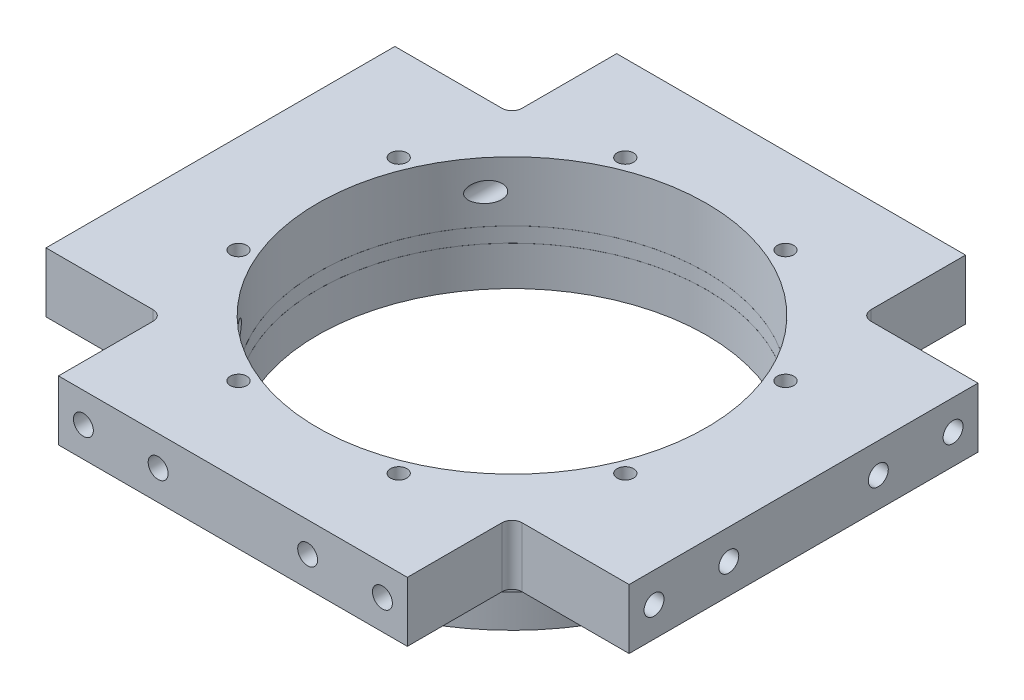
from build123d import *

# Parameters (mm, degrees)
SKETCH_2_OUTSIDE_W          = 233.118
SKETCH_2_OUTSIDE_H          = 233.118
SKETCH_2_OUTSIDE_W_2        = 117
SKETCH_2_OUTSIDE_H_2        = 112
CUT_EXTRUDE_1_DEPTH         = 12
SKETCH_4_R                  = 2
CUT_EXTRUDE_3_DEPTH         = 129.41596474
SKETCH_5_R                  = 2
CUT_EXTRUDE_4_DEPTH         = 12
CUT_EXTRUDE_START           = -105
SKETCH_5_2_R                = 2
CUT_EXTRUDE_5_DEPTH         = 12
SKETCH_6_R                  = 1.65
CUT_EXTRUDE_6_DEPTH         = 100
SKETCH_10_R                 = 2.1
CUT_EXTRUDE_8_DEPTH         = 10.9
PATTERN_CIRCULAR_1_COUNT    = 8
CUT_EXTRUDE_7_DEPTH         = 20
CUT_EXTRUDE_3395_DEPTH      = 85.158540956
CUT_EXTRUDE_3395_DEPTH_BACK = 85.158540956
SKETCH_11_W                 = 136.197392648
SKETCH_11_H                 = 0.01
SKETCH_12_W                 = 23.5
SKETCH_12_H                 = 18
CUT_EXTRUDE_9_DEPTH         = 50
SKETCH_13_W                 = 20.5
SKETCH_13_H                 = 3
CUT_EXTRUDE_10_DEPTH        = 40
F_4_0MM_1_AT_2_COUNT        = 2
F_4_0MM_1_AT_2_PITCH        = 30
F_4_0MM_2_AT_2_COUNT        = 2
F_4_0MM_2_AT_2_PITCH        = 30


with BuildPart() as part:
    # 草图1 → 旋转1 (revolve)
    with BuildSketch(Plane.XY, mode=Mode.PRIVATE) as revolve_1_sk:
        Polygon((-39, 0), (-45, 0), (-45, 7.9), (-46.8, 7.9), (-46.8, 10.9), (-90, 10.9), (-90, 22.9), (-39, 22.9), align=None)
    revolve(revolve_1_sk.sketch.rotate(Axis((0, 0, 0), (0, 1, 0)), 270), axis=Axis((0, 0, 0), (0, 1, 0)))

    # 草图2 outside → 切除-拉伸1 (cut)
    with BuildSketch(Plane(origin=(0, 22.9, 0), x_dir=(1, 0, 0), z_dir=(0, 1, 0))):
        Rectangle(SKETCH_2_OUTSIDE_W, SKETCH_2_OUTSIDE_H)
        Rectangle(SKETCH_2_OUTSIDE_W_2, SKETCH_2_OUTSIDE_H_2, mode=Mode.SUBTRACT)
    extrude(amount=-CUT_EXTRUDE_1_DEPTH, mode=Mode.SUBTRACT)

    # 草图4 → 切除-拉伸3 (cut, through all)
    with BuildSketch(Plane.XY.offset(56)):
        with Locations((-30, 16.9)):
            Circle(SKETCH_4_R)
        with Locations((30, 16.9)):
            Circle(SKETCH_4_R)
    extrude(amount=-CUT_EXTRUDE_3_DEPTH, mode=Mode.SUBTRACT)

    # 草图5 → 切除-拉伸4 (cut)
    with BuildSketch(Plane.ZY.offset(58.5)):
        with Locations((-30, 16.9)):
            Circle(SKETCH_5_R)
        with Locations((30, 16.9)):
            Circle(SKETCH_5_R)
    extrude(amount=-CUT_EXTRUDE_4_DEPTH, mode=Mode.SUBTRACT)

    # 草图5<2> → 切除-拉伸5 (cut)
    with BuildSketch(Plane.ZY.offset(58.5).offset(CUT_EXTRUDE_START)):
        with Locations((-30, 16.9)):
            Circle(SKETCH_5_2_R)
        with Locations((30, 16.9)):
            Circle(SKETCH_5_2_R)
    extrude(amount=-CUT_EXTRUDE_5_DEPTH, mode=Mode.SUBTRACT)

    # 草图6 → 切除-拉伸6 (cut)
    with BuildSketch(Plane.XZ):
        with Locations(Location((-16.072704159, -38.802940365, 0), (0, 0, 270))):
            Circle(SKETCH_6_R)
    cut_extrude_6 = extrude(amount=-CUT_EXTRUDE_6_DEPTH, mode=Mode.SUBTRACT)

    # 草图10 → 切除-拉伸8 (cut)
    with BuildSketch(Plane.XZ):
        with Locations(Location((-16.072704159, -38.802940365, 0), (0, 0, 270))):
            Circle(SKETCH_10_R)
    cut_extrude_8 = extrude(amount=-CUT_EXTRUDE_8_DEPTH, mode=Mode.SUBTRACT)

    # 阵列(圆周)1: 切除-拉伸6, 切除-拉伸8 ×8 about axis
    pattern_circular_1_axis = Axis((0, 0, 0), (0, 1, 0))
    add([cut_extrude_6.rotate(pattern_circular_1_axis, i * 360 / PATTERN_CIRCULAR_1_COUNT) for i in range(1, PATTERN_CIRCULAR_1_COUNT)], mode=Mode.SUBTRACT)
    add([cut_extrude_8.rotate(pattern_circular_1_axis, i * 360 / PATTERN_CIRCULAR_1_COUNT) for i in range(1, PATTERN_CIRCULAR_1_COUNT)], mode=Mode.SUBTRACT)

    # 草图7 → 切除-拉伸7 (cut)
    with BuildSketch(Plane(origin=(0, 22.9, 0), x_dir=(1, 0, 0), z_dir=(0, 1, 0))):
        with BuildLine():
            Line((-37, 35), (-38, 35))
            ThreePointArc((-38, 35), (-39.414213562, 35.585786438), (-40, 37))
            Line((-40, 37), (-40, 38))
            ThreePointArc((-40, 38), (-39.414213562, 39.414213562), (-38, 40))
            Line((-38, 40), (-37, 40))
            ThreePointArc((-37, 40), (-35.585786438, 39.414213562), (-35, 38))
            Line((-35, 38), (-35, 37))
            ThreePointArc((-35, 37), (-35.585786438, 35.585786438), (-37, 35))
        make_face()
        with BuildLine():
            Line((37, 35), (38, 35))
            ThreePointArc((38, 35), (39.414213562, 35.585786438), (40, 37))
            Line((40, 37), (40, 38))
            ThreePointArc((40, 38), (39.414213562, 39.414213562), (38, 40))
            Line((38, 40), (37, 40))
            ThreePointArc((37, 40), (35.585786438, 39.414213562), (35, 38))
            Line((35, 38), (35, 37))
            ThreePointArc((35, 37), (35.585786438, 35.585786438), (37, 35))
        make_face()
        with BuildLine():
            Line((37, -35), (38, -35))
            ThreePointArc((38, -35), (39.414213562, -35.585786438), (40, -37))
            Line((40, -37), (40, -38))
            ThreePointArc((40, -38), (39.414213562, -39.414213562), (38, -40))
            Line((38, -40), (37, -40))
            ThreePointArc((37, -40), (35.585786438, -39.414213562), (35, -38))
            Line((35, -38), (35, -37))
            ThreePointArc((35, -37), (35.585786438, -35.585786438), (37, -35))
        make_face()
        with BuildLine():
            Line((-37, -35), (-38, -35))
            ThreePointArc((-38, -35), (-39.414213562, -35.585786438), (-40, -37))
            Line((-40, -37), (-40, -38))
            ThreePointArc((-40, -38), (-39.414213562, -39.414213562), (-38, -40))
            Line((-38, -40), (-37, -40))
            ThreePointArc((-37, -40), (-35.585786438, -39.414213562), (-35, -38))
            Line((-35, -38), (-35, -37))
            ThreePointArc((-35, -37), (-35.585786438, -35.585786438), (-37, -35))
        make_face()
    extrude(amount=-CUT_EXTRUDE_7_DEPTH, mode=Mode.SUBTRACT)

    # 草图11 → Cut-Extrude 3395 (cut, two sides: drawn at the far end of the back side and taken through both)
    with BuildSketch(Plane(origin=(0, 0, 0), x_dir=(0, 0, -1), z_dir=(1, 0, 0)).offset(-CUT_EXTRUDE_3395_DEPTH_BACK)):
        with Locations((-5.996836933, 7.895)):
            Rectangle(SKETCH_11_W, SKETCH_11_H)
        with Locations((-5.996836933, 10.895)):
            Rectangle(SKETCH_11_W, SKETCH_11_H)
    extrude(amount=CUT_EXTRUDE_3395_DEPTH + CUT_EXTRUDE_3395_DEPTH_BACK, mode=Mode.SUBTRACT)


with BuildPart() as cut_extrude_3395_piece_1:
    # of the separate pieces the step leaves, piece 1, a body of its own (cut_extrude_3395_pieces)
    add(part.part.solids().sort_by_distance((40.452940365, 10.9, -16.072704159))[0])

    # 草图12 → 切除-拉伸9 (cut)
    with BuildSketch(Plane(origin=(0, 22.9, 0), x_dir=(1, 0, 0), z_dir=(0, 1, 0))):
        with Locations((46.75, -47)):
            Rectangle(SKETCH_12_W, SKETCH_12_H)
        with Locations((-46.75, -47)):
            Rectangle(SKETCH_12_W, SKETCH_12_H)
    cut_extrude_9 = extrude(amount=-CUT_EXTRUDE_9_DEPTH, mode=Mode.SUBTRACT)

    # 镜向1: 切除-拉伸9 across plane
    add(cut_extrude_9.mirror(Plane.XY), mode=Mode.SUBTRACT)

    # 草图13 → 切除-拉伸10 (cut)
    with BuildSketch(Plane(origin=(0, 22.9, 0), x_dir=(1, 0, 0), z_dir=(0, 1, 0))):
        with Locations((48.25, -36.5)):
            Rectangle(SKETCH_13_W, SKETCH_13_H)
        with Locations((-48.25, -36.5)):
            Rectangle(SKETCH_13_W, SKETCH_13_H)
        with Locations((-48.25, 36.5)):
            Rectangle(SKETCH_13_W, SKETCH_13_H)
        with Locations((48.25, 36.5)):
            Rectangle(SKETCH_13_W, SKETCH_13_H)
    extrude(amount=-CUT_EXTRUDE_10_DEPTH, mode=Mode.SUBTRACT)

    # 草图16 → Ø4.0mm 暗销孔1 (revolve, cut)
    with BuildSketch(Plane(origin=(-15, 16.9, 56), x_dir=(0, -1, 0), z_dir=(1, 0, 0))):
        Polygon((0, 0), (0, 11.201721238), (2, 10), (2, 0), align=None)
    f_4_0mm_1 = revolve(axis=Axis((-15, 16.9, 62.35), (0, 0, -1)), mode=Mode.SUBTRACT)

    # Ø4.0mm 暗销孔1 at 2: Ø4.0mm 暗销孔1 ×2
    with Locations(*[(i * F_4_0MM_1_AT_2_PITCH, 0, 0) for i in range(1, F_4_0MM_1_AT_2_COUNT)]):
        add(f_4_0mm_1, mode=Mode.SUBTRACT)

    # 镜向2: Ø4.0mm 暗销孔1 across plane
    add(f_4_0mm_1.mirror(Plane.XY), mode=Mode.SUBTRACT)

    # 镜向2 copy 1 sketch → 镜向2 copy 1 (revolve, cut)
    with BuildSketch(Plane(origin=(15, 16.9, -56), x_dir=(0, -1, 0), z_dir=(1, 0, 0))):
        Polygon((0, 0), (0, -11.201721238), (2, -10), (2, 0), align=None)
    revolve(axis=Axis((15, 16.9, -62.35), (0, 0, -1)), mode=Mode.SUBTRACT)

    # 草图19 → Ø4.0mm 暗销孔2 (revolve, cut)
    with BuildSketch(Plane(origin=(58.5, 16.9, 15), x_dir=(0, 0, -1), z_dir=(0, 1, 0))):
        Polygon((0, 0), (0, 11.201721238), (2, 10), (2, 0), align=None)
    f_4_0mm_2 = revolve(axis=Axis((64.85, 16.9, 15), (-1, 0, 0)), mode=Mode.SUBTRACT)

    # Ø4.0mm 暗销孔2 at 2: Ø4.0mm 暗销孔2 ×2
    with Locations(*[(0, 0, -i * F_4_0MM_2_AT_2_PITCH) for i in range(1, F_4_0MM_2_AT_2_COUNT)]):
        add(f_4_0mm_2, mode=Mode.SUBTRACT)

    # 镜向3: Ø4.0mm 暗销孔2 across plane
    add(f_4_0mm_2.mirror(Plane(origin=(0, 0, 0), x_dir=(0, 0, 1), z_dir=(1, 0, 0))), mode=Mode.SUBTRACT)

    # 镜向3 copy 1 sketch → 镜向3 copy 1 (revolve, cut)
    with BuildSketch(Plane(origin=(-58.5, 16.9, -15), x_dir=(0, 0, -1), z_dir=(0, 1, 0))):
        Polygon((0, 0), (0, -11.201721238), (2, -10), (2, 0), align=None)
    revolve(axis=Axis((-64.85, 16.9, -15), (-1, 0, 0)), mode=Mode.SUBTRACT)


with BuildPart() as cut_extrude_3395_piece_2:
    # of the separate pieces the step leaves, piece 2, a body of its own (cut_extrude_3395_pieces)
    add(part.part.solids().sort_by_distance((0, 0, -45))[0])


with BuildPart() as cut_extrude_3395_piece_3:
    # of the separate pieces the step leaves, piece 3, a body of its own (cut_extrude_3395_pieces)
    add(part.part.solids().sort_by_distance((0, 7.9, -46.8))[0])


solid = Compound([cut_extrude_3395_piece_1.part, cut_extrude_3395_piece_2.part, cut_extrude_3395_piece_3.part])
